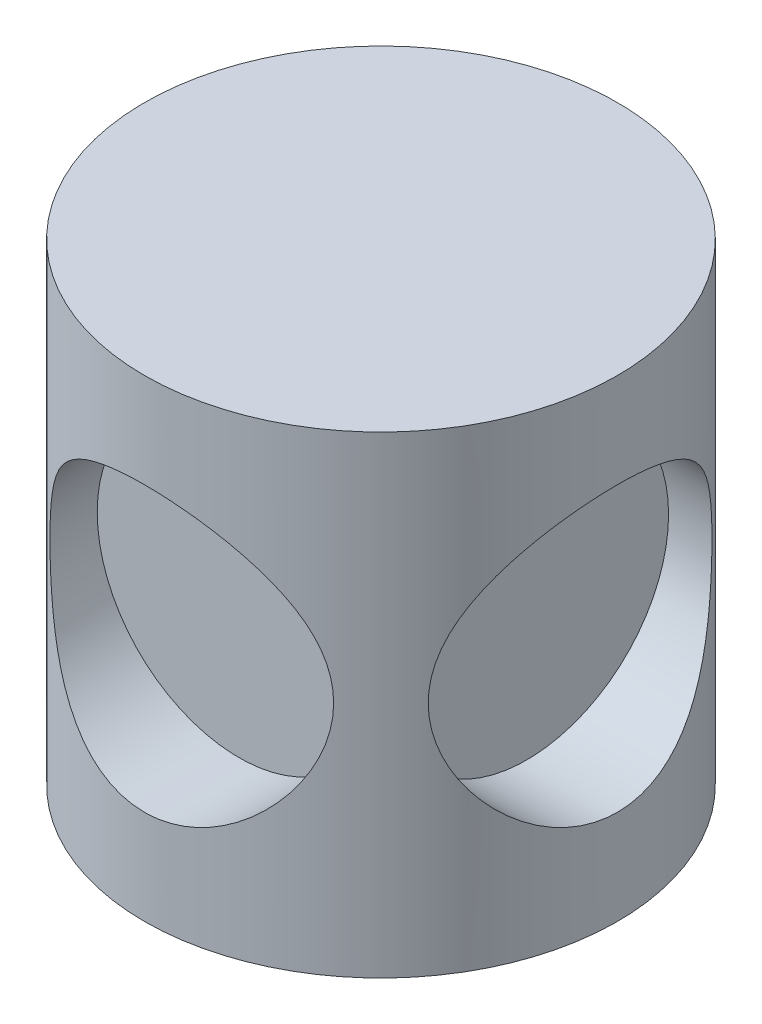
from build123d import *

# Parameters (mm, degrees)
SKETCH1_R           = 50
BOSS_EXTRUDE1_DEPTH = 100
SKETCH2_R           = 30
CUT_EXTRUDE1_DEPTH  = 20
SKETCH3_R           = 30
CUT_EXTRUDE2_DEPTH  = 20


with BuildPart() as part:
    # Sketch1 → Boss-Extrude1 (new body)
    with BuildSketch(Plane(origin=(0, 0, 0), x_dir=(1, 0, 0), z_dir=(0, 1, 0))):
        with Locations(Location((0, 0, 0), (0, 0, 270))):
            Circle(SKETCH1_R)
    extrude(amount=BOSS_EXTRUDE1_DEPTH)

    # Sketch2 → Cut-Extrude1 (cut)
    with BuildSketch(Plane.XY.offset(50)):
        with Locations((0, 50)):
            Circle(SKETCH2_R)
    extrude(amount=-CUT_EXTRUDE1_DEPTH, mode=Mode.SUBTRACT)

    # Sketch3 → Cut-Extrude2 (cut)
    with BuildSketch(Plane(origin=(50.830291615, 0, 0), x_dir=(0, 0, -1), z_dir=(1, 0, 0))):
        with Locations((0, 50)):
            Circle(SKETCH3_R)
    extrude(amount=-CUT_EXTRUDE2_DEPTH, mode=Mode.SUBTRACT)


solid = part.part
